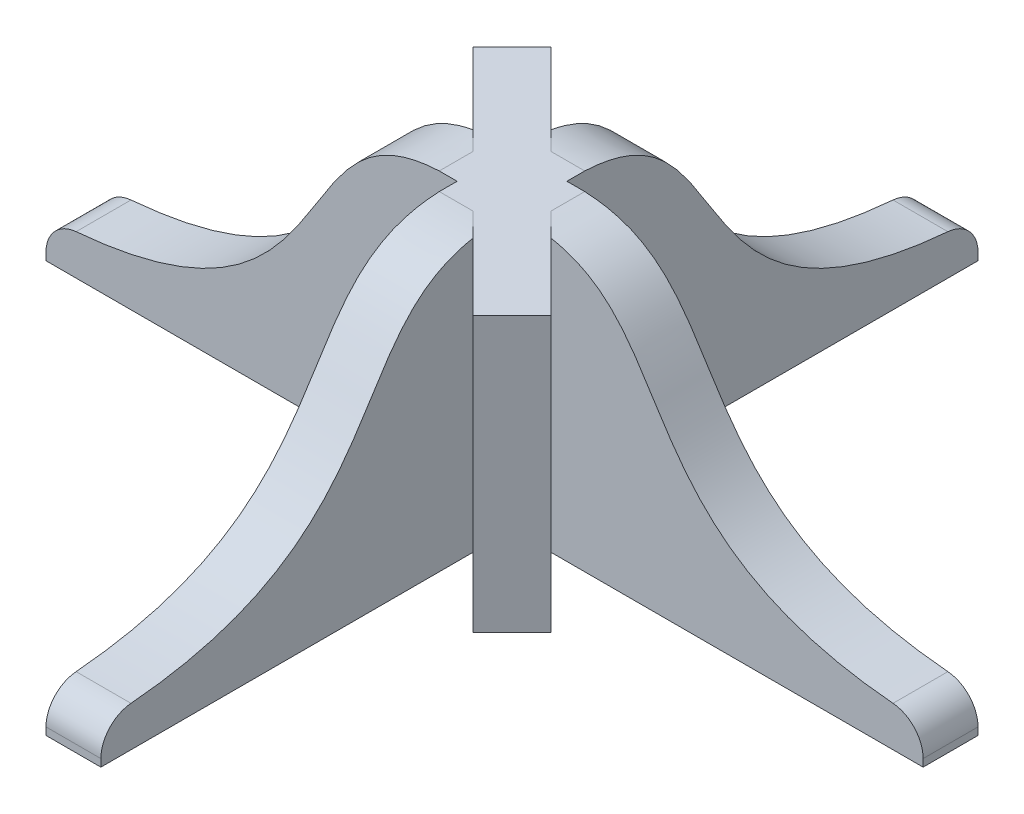
from build123d import *

# Parameters (mm, degrees)
SKETCH3_W           = 30
SKETCH3_H           = 5
SKETCH3_W_2         = 5
SKETCH3_H_2         = 30
BOSS_EXTRUDE2_DEPTH = 25
CUT_EXTRUDE2_DEPTH  = 35.003676272
BOSS_EXTRUDE3_DEPTH = 5
SKETCH9_W           = 12.5
SKETCH9_H           = 5
CUT_EXTRUDE3_DEPTH  = 50.460787365
CIRPATTERN9_COUNT   = 4
SKETCH11_W          = 30
SKETCH11_H          = 25
BOSS_EXTRUDE5_DEPTH = 2.5
FILLET1_R           = 3


with BuildPart() as part:
    # Sketch3 → Boss-Extrude2 (new body)
    with BuildSketch(Plane(origin=(0, 0, 0), x_dir=(1, 0, 0), z_dir=(0, 1, 0))):
        Rectangle(SKETCH3_W, SKETCH3_H)
        Rectangle(SKETCH3_W_2, SKETCH3_H_2)
    extrude(amount=BOSS_EXTRUDE2_DEPTH)

    # Sketch4 → Cut-Extrude2 (cut, symmetric)
    with BuildSketch(Plane(origin=(2.5, 0, 0), x_dir=(0, 0, -1), z_dir=(1, 0, 0))):
        with BuildLine():
            Line((-15, 25), (-15, 17.357377201))
            add(Edge.make_bspline(
                [(-15, 17.357377201), (-12.472140197, 21.356054213), (-10.128526377, 24.727998236), (-4.127581327, 25)],
                knots=[0.577139171, 0.577139171, 0.577139171, 0.577139171, 0.966590179, 0.966590179, 0.966590179, 0.966590179], degree=3))
            Line((-4.127581327, 25), (-15, 25))
        make_face()
    cut_extrude2 = extrude(amount=CUT_EXTRUDE2_DEPTH, both=True, mode=Mode.SUBTRACT)

    # Sketch5 → Boss-Extrude3 (add)
    with BuildSketch(Plane(origin=(2.5, 0, 0), x_dir=(0, 0, -1), z_dir=(1, 0, 0))):
        with BuildLine():
            Line((-39.95459265, 0), (-15, 0))
            Line((-15, 0), (-15, 17.357377201))
            add(Edge.make_bspline(
                [(-39.95459265, 3.5), (-22.896848779, 4.129478661), (-18.746111538, 11.431617363), (-15, 17.357377201)],
                knots=[0, 0, 0, 0, 0.577139171, 0.577139171, 0.577139171, 0.577139171], degree=3))
            Line((-39.95459265, 3.5), (-39.95459265, 0))
        make_face()
    boss_extrude3 = extrude(amount=-BOSS_EXTRUDE3_DEPTH)

    # Mirror1: Boss-Extrude3 across plane
    add(boss_extrude3.mirror(Plane.XY))

    # Mirror2: Cut-Extrude2 across plane
    add(cut_extrude2.mirror(Plane.XY), mode=Mode.SUBTRACT)

    # Sketch9 → Cut-Extrude3 (cut, through all)
    with BuildSketch(Plane(origin=(0, 25, 0), x_dir=(1, 0, 0), z_dir=(0, 1, 0))):
        with Locations((-8.75, 0)):
            Rectangle(SKETCH9_W, SKETCH9_H)
        with Locations((8.75, 0)):
            Rectangle(SKETCH9_W, SKETCH9_H)
    extrude(amount=-CUT_EXTRUDE3_DEPTH, mode=Mode.SUBTRACT)


with BuildPart() as cirpattern9_1:
    # CirPattern9: pattern copy
    add(part.part.rotate(Axis((0, 0, 0), (0, 1, 0)), 1 * 360 / CIRPATTERN9_COUNT))


with BuildPart() as cirpattern9_2:
    # CirPattern9: pattern copy
    add(part.part.rotate(Axis((0, 0, 0), (0, 1, 0)), 2 * 360 / CIRPATTERN9_COUNT))


with BuildPart() as cirpattern9_3:
    # CirPattern9: pattern copy
    add(part.part.rotate(Axis((0, 0, 0), (0, 1, 0)), 3 * 360 / CIRPATTERN9_COUNT))


with BuildPart() as part_1:
    add(part.part)

    add(cirpattern9_1.part)  # Boss-Extrude5 merges CirPattern9_1

    add(cirpattern9_2.part)  # Boss-Extrude5 merges CirPattern9_2

    add(cirpattern9_3.part)  # Boss-Extrude5 merges CirPattern9_3
    # Sketch11 → Boss-Extrude5 (add, symmetric)
    with BuildSketch(Plane(origin=(0, 0, 0), x_dir=(0.7071067811865489, 0, 0.7071067811865462), z_dir=(-0.7071067811865462, 0, 0.7071067811865489))):
        with Locations((0, 12.5)):
            Rectangle(SKETCH11_W, SKETCH11_H)
    extrude(amount=BOSS_EXTRUDE5_DEPTH, both=True)

    # Fillet1
    fillet1_edges = [part_1.edges().sort_by_distance(p)[0] for p in [
        (0, 3.5, 39.95459265),
        (0, 3.5, -39.95459265),
        (39.95459265, 3.5, 0),
        (-39.95459265, 3.5, 0),
    ]]
    fillet(fillet1_edges, radius=FILLET1_R)


solid = part_1.part
